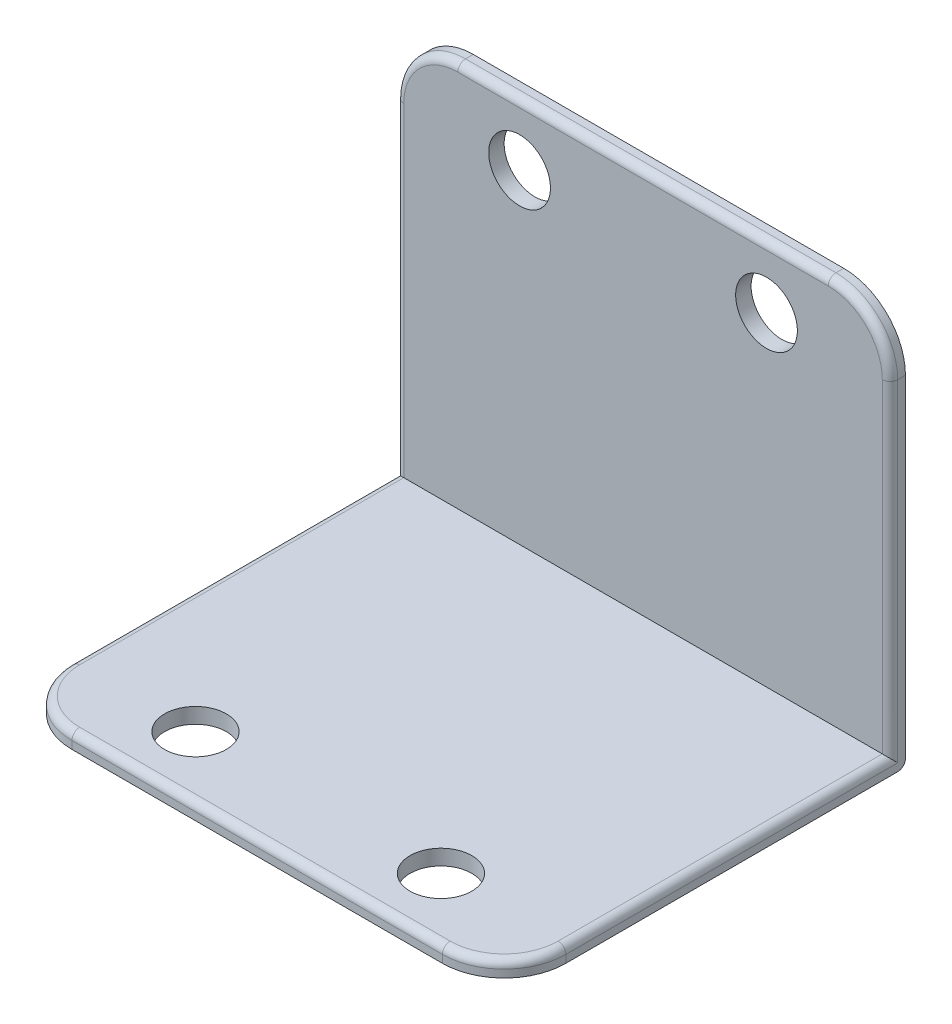
from build123d import *

# Parameters (mm, degrees)
SKETCH1_W           = 32
SKETCH1_H           = 26
SKETCH1_R           = 2
BOSS_EXTRUDE1_DEPTH = 1
FILLET1_R           = 4
FILLET2_R           = 4
SKETCH2_W           = 32
SKETCH2_H           = 1
BOSS_EXTRUDE2_DEPTH = 25
FILLET3_R           = 4
FILLET4_R           = 4
SKETCH3_R           = 2
CUT_EXTRUDE1_DEPTH  = 40.458839314
FILLET5_R           = 0.5
FILLET6_R           = 0.5
FILLET7_R           = 0.5


with BuildPart() as part:
    # Sketch1 → Boss-Extrude1 (new body)
    with BuildSketch(Plane(origin=(0, 0, 0), x_dir=(1, 0, 0), z_dir=(0, 1, 0))):
        Rectangle(SKETCH1_W, SKETCH1_H)
        with Locations(Location((-8, -9, 0), (0, 0, 270))):
            Circle(SKETCH1_R, mode=Mode.SUBTRACT)
        with Locations(Location((7.905303365, -9, 0), (0, 0, 270))):
            Circle(SKETCH1_R, mode=Mode.SUBTRACT)
    extrude(amount=BOSS_EXTRUDE1_DEPTH)

    # Fillet1
    fillet1_edges = [part.edges().sort_by_distance(p)[0] for p in [
        (-16, 0.5, 13),
    ]]
    fillet(fillet1_edges, radius=FILLET1_R)

    # Fillet2
    fillet2_edges = [part.edges().sort_by_distance(p)[0] for p in [
        (16, 0.5, 13),
    ]]
    fillet(fillet2_edges, radius=FILLET2_R)

    # Sketch2 → Boss-Extrude2 (add)
    with BuildSketch(Plane(origin=(0, 1, 0), x_dir=(1, 0, 0), z_dir=(0, 1, 0))):
        with Locations((0, 12.5)):
            Rectangle(SKETCH2_W, SKETCH2_H)
    extrude(amount=BOSS_EXTRUDE2_DEPTH)

    # Fillet3
    fillet3_edges = [part.edges().sort_by_distance(p)[0] for p in [
        (16, 26, -12.5),
    ]]
    fillet(fillet3_edges, radius=FILLET3_R)

    # Fillet4
    fillet4_edges = [part.edges().sort_by_distance(p)[0] for p in [
        (-16, 26, -12.5),
    ]]
    fillet(fillet4_edges, radius=FILLET4_R)

    # Sketch3 → Cut-Extrude1 (cut, through all)
    with BuildSketch(Plane.XY.offset(-12)):
        with Locations((-8, 22)):
            Circle(SKETCH3_R)
        with Locations((8, 22)):
            Circle(SKETCH3_R)
    extrude(amount=-CUT_EXTRUDE1_DEPTH, mode=Mode.SUBTRACT)

    # Fillet5
    fillet5_edges = [part.edges().sort_by_distance(p)[0] for p in [
        (16, 11.5, -12),
        (14.828427125, 24.828427125, -12),
        (0, 26, -12),
        (-16, 11.5, -12),
        (-14.828427125, 24.828427125, -12),
    ]]
    fillet(fillet5_edges, radius=FILLET5_R)

    # Fillet6
    fillet6_edges = [part.edges().sort_by_distance(p)[0] for p in [
        (16, 1, -1.75),
        (14.828427125, 1, 11.828427125),
        (0, 1, 13),
        (-14.828427125, 1, 11.828427125),
        (-16, 1, -1.75),
    ]]
    fillet(fillet6_edges, radius=FILLET6_R)

    # Fillet7
    fillet7_edges = [part.edges().sort_by_distance(p)[0] for p in [
        (0, 0, -13),
    ]]
    fillet(fillet7_edges, radius=FILLET7_R)


solid = part.part
